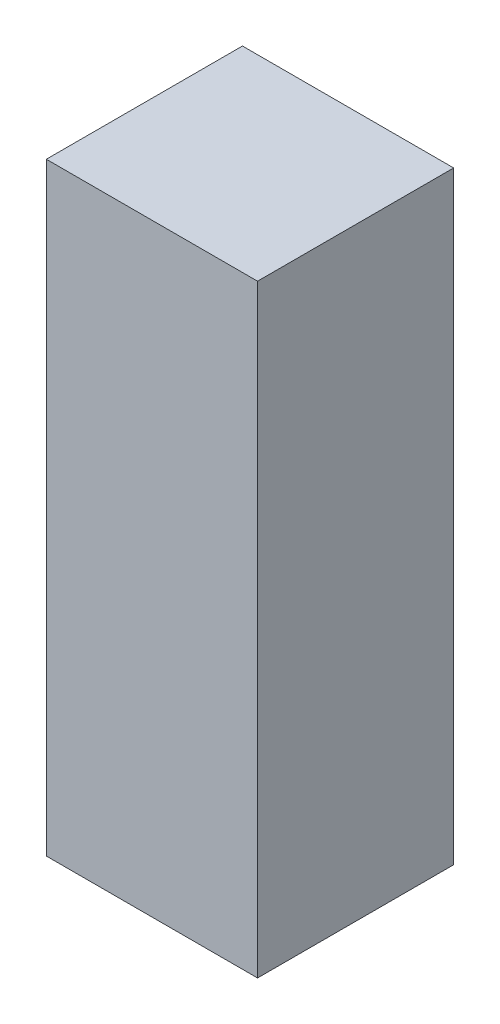
from build123d import *

# Parameters (mm, degrees)
OVEN_FAN_FILTRE_KAPAGI_MENTESE_1_1_START = 20
SKETCH1_W                                = 14
SKETCH1_H                                = 40
OVEN_FAN_FILTRE_KAPAGI_MENTESE_1_1_DEPTH = 13


with BuildPart() as part:
    # Sketch1 → OVEN_fan_filtre_kapagi_mentese_1_1 (new body)
    with BuildSketch(Plane.XY.offset(OVEN_FAN_FILTRE_KAPAGI_MENTESE_1_1_START)):
        with Locations((31, 1740)):
            Rectangle(SKETCH1_W, SKETCH1_H)
    extrude(amount=OVEN_FAN_FILTRE_KAPAGI_MENTESE_1_1_DEPTH)


solid = part.part
